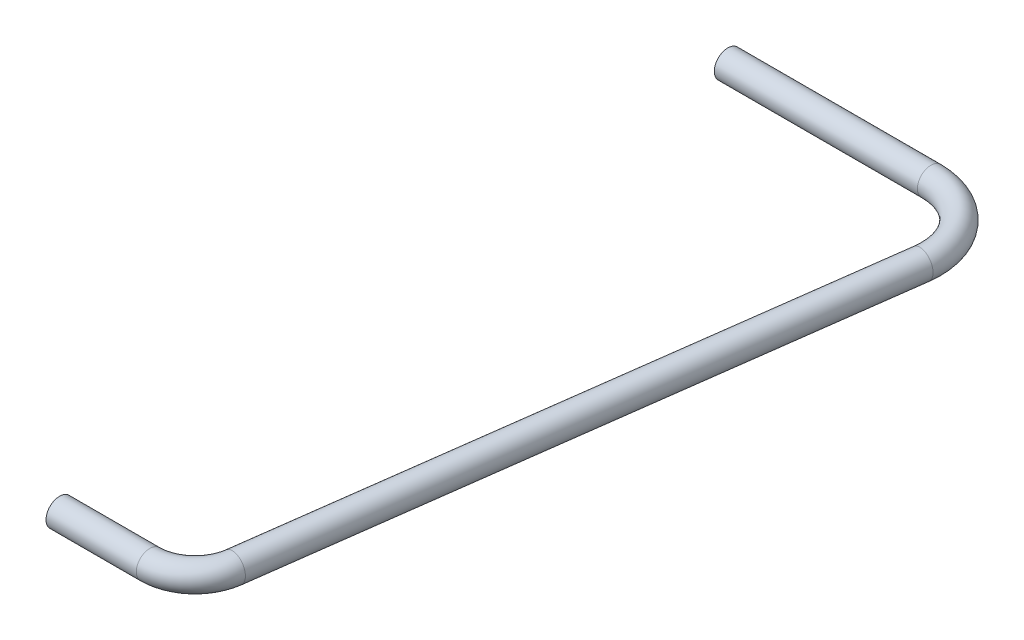
from build123d import *

# Parameters (mm, degrees)
SWEEP1_PROFILE_R = 3


with BuildPart() as part:
    # Sweep1: sweep along a path in Sketch1
    with BuildLine(Plane(origin=(0, 0, 0), x_dir=(1, 0, 0), z_dir=(0, 1, 0))) as sweep1_path:
        Line((-0.572453609, 78.592306281), (19.427546391, 78.592306281))
        ThreePointArc((19.427546391, 78.592306281), (26.013575206, 81.067399341), (29.339397178, 87.26746139))
        Line((29.339397178, 87.26746139), (47.295322571, 221.605038945))
        ThreePointArc((47.295322571, 221.605038945), (43.714906801, 233.471349503), (32.427546391, 238.592306281))
        Line((32.427546391, 238.592306281), (-12.572453609, 238.592306281))
    # Sweep1 profile (on start of the path) → Sweep1 (sweep)
    with BuildSketch(Plane(origin=(-0.572453609, 0, -78.592306281), x_dir=(0, 0, 1), z_dir=(1, 0, 0))):
        Circle(SWEEP1_PROFILE_R)
    sweep(path=sweep1_path.line)


solid = part.part
